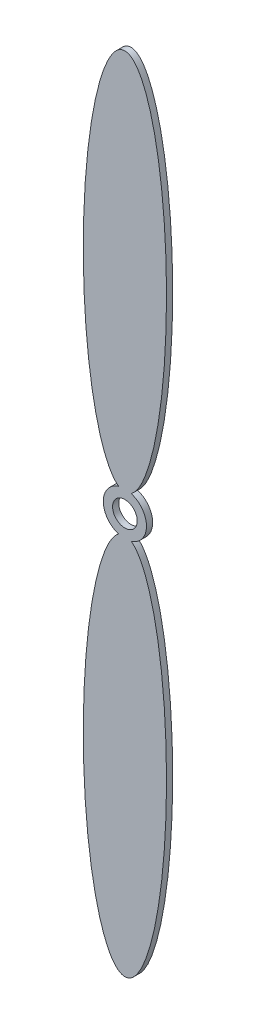
from build123d import *

# Parameters (mm, degrees)
SKETCH1_R           = 7
SKETCH1_R_2         = 4
SKETCH1_RX          = 62
SKETCH1_RY          = 13.5
BOSS_EXTRUDE3_DEPTH = 2


with BuildPart() as part:
    # Sketch1 → Boss-Extrude3 (new body)
    # profile 1 of 3: a face of its own
    with BuildSketch(Plane.XY):
        Circle(SKETCH1_R)
        Circle(SKETCH1_R_2, mode=Mode.SUBTRACT)
    # profile 2 of 3: a face of its own
    with BuildSketch(Plane.XY):
        with Locations(Location((0, 68), (0, 0, 90))):
            Ellipse(SKETCH1_RX, SKETCH1_RY)
    # profile 3 of 3: a face of its own
    with BuildSketch(Plane.XY):
        with Locations(Location((0, -68), (0, 0, -90))):
            Ellipse(SKETCH1_RX, SKETCH1_RY)
    extrude(amount=BOSS_EXTRUDE3_DEPTH)


solid = part.part
